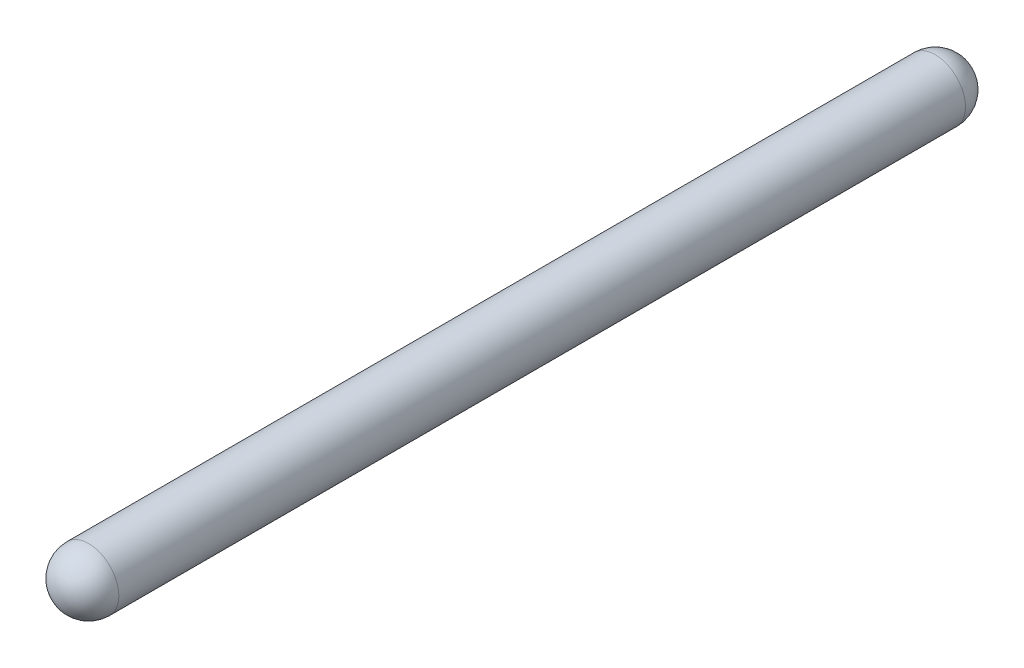
from build123d import *

# Parameters (mm, degrees)
SKETCH2_R           = 1
BOSS_EXTRUDE4_DEPTH = 30
FILLET2_R           = 1


with BuildPart() as part:
    # Sketch2 → Boss-Extrude4 (new body)
    with BuildSketch(Plane.XY):
        Circle(SKETCH2_R)
    extrude(amount=BOSS_EXTRUDE4_DEPTH)

    # Fillet2
    fillet2_edges = [part.edges().sort_by_distance(p)[0] for p in [
        (-1, 0, 0),
        (-1, 0, 30),
    ]]
    fillet(fillet2_edges, radius=FILLET2_R)


solid = part.part
